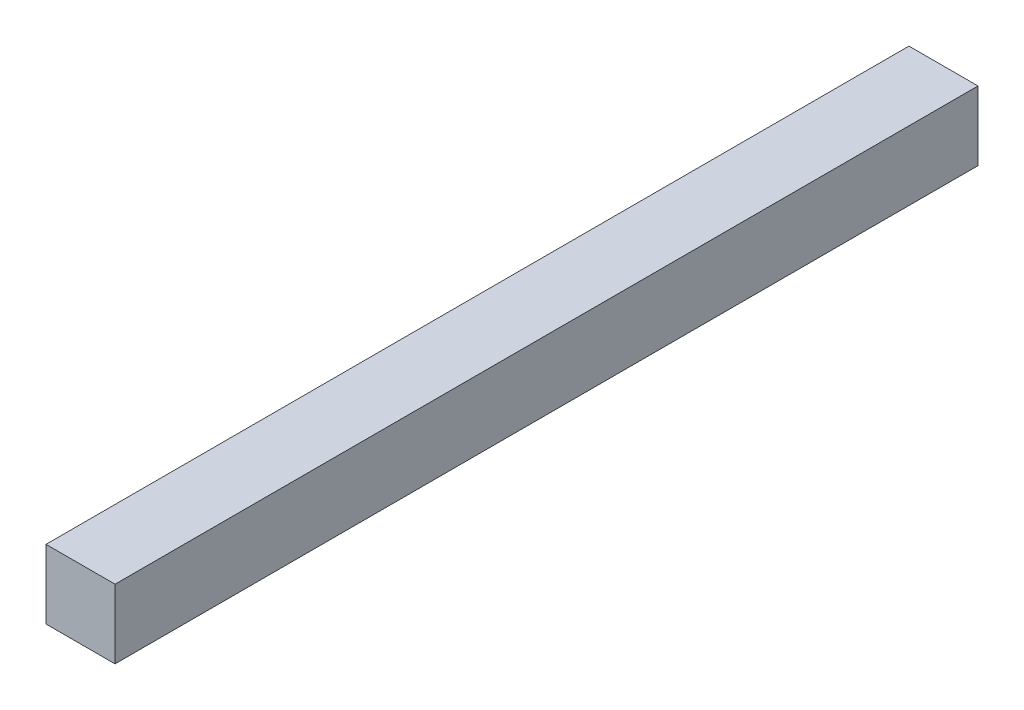
from build123d import *

# Parameters (mm, degrees)
SKETCH_1_W      = 20
SKETCH_1_H      = 20
EXTRUDE_1_DEPTH = 250


with BuildPart() as part:
    # 草图1 → 凸台-拉伸1 (new body)
    with BuildSketch(Plane.XY):
        Rectangle(SKETCH_1_W, SKETCH_1_H)
    extrude(amount=EXTRUDE_1_DEPTH)


solid = part.part
